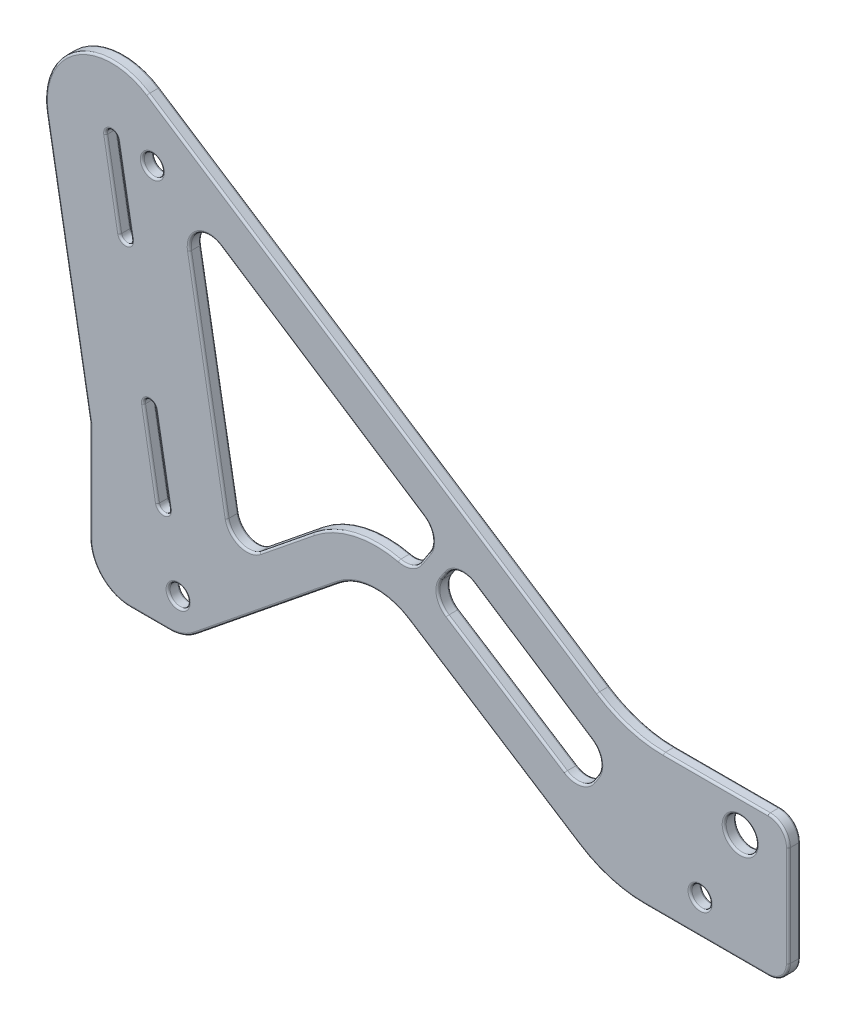
from build123d import *

# Parameters (mm, degrees)
SKETCH1_R           = 2.5
SKETCH1_R_2         = 4
BOSS_EXTRUDE1_DEPTH = 3
FILLET1_R           = 5
CUT_EXTRUDE1_DEPTH  = 10
CUT_EXTRUDE2_DEPTH  = 10
FILLET3_R           = 30
FILLET4_R           = 10
FILLET5_R           = 0.5
SKETCH4_R           = 2.5
CUT_EXTRUDE3_DEPTH  = 10
FILLET6_R           = 0.5


with BuildPart() as part:
    # Sketch1 → Boss-Extrude1 (new body)
    # profile 1 of 3: a face of its own
    with BuildSketch(Plane.XY):
        with BuildLine():
            Line((0, 21.354191767), (0, 35))
            Line((0, 35), (-36.042003765, 35))
            Line((-36.042003765, 35), (-47.769437248, 35))
            Line((-47.769437248, 35), (-136.490921808, 35))
            Line((-136.490921808, 35), (-148.304829515, 102))
            ThreePointArc((-148.304829515, 102), (-150.785627379, 108.227526332), (-155.539001023, 112.954246258))
            ThreePointArc((-155.539001023, 112.954246258), (-173.646878703, 112.903335129), (-180.803485365, 96.269610137))
            Line((-180.803485365, 96.269610137), (-170, 35))
            Line((-170, 35), (-170, 0))
            Line((-170, 0), (0, 0))
            Line((0, 0), (0, 21.354191767))
        make_face()
        with Locations((-148, 8.5)):
            Circle(SKETCH1_R, mode=Mode.SUBTRACT)
        with BuildLine():
            ThreePointArc((-156.60869326, 45.435682794), (-155.391953897, 47.17336669), (-153.654270001, 45.956627327))
            Line((-153.654270001, 45.956627327), (-150.181306448, 26.260472267))
            ThreePointArc((-150.181306448, 26.260472267), (-151.398045811, 24.52278837), (-153.135729707, 25.739527733))
            Line((-153.135729707, 25.739527733), (-156.60869326, 45.435682794))
        make_face(mode=Mode.SUBTRACT)
        with Locations((-18, 8.5)):
            Circle(SKETCH1_R, mode=Mode.SUBTRACT)
        with Locations((-8, 27)):
            Circle(SKETCH1_R_2, mode=Mode.SUBTRACT)
        with BuildLine():
            Line((-162.558405516, 79.178177742), (-166.031369069, 98.874332802))
            ThreePointArc((-166.031369069, 98.874332802), (-164.814629706, 100.612016698), (-163.07694581, 99.395277335))
            Line((-163.07694581, 99.395277335), (-159.603982257, 79.699122275))
            ThreePointArc((-159.603982257, 79.699122275), (-160.82072162, 77.961438379), (-162.558405516, 79.178177742))
        make_face(mode=Mode.SUBTRACT)
    # profile 2 of 3: a face of its own
    with BuildSketch(Plane.XY):
        Polygon((4, 35), (0, 35), (0, 21.354191767), (0, 0), (4, 0), align=None)
    # profile 3 of 3: a face of its own
    with BuildSketch(Plane.XY):
        with BuildLine():
            Line((-47.769437248, 35), (-36.042003765, 35))
            Line((-36.042003765, 35), (-155.539001023, 112.954246258))
            ThreePointArc((-155.539001023, 112.954246258), (-150.785627379, 108.227526332), (-148.304829515, 102))
            Line((-148.304829515, 102), (-136.490921808, 35))
            Line((-136.490921808, 35), (-47.769437248, 35))
        make_face()
    extrude(amount=BOSS_EXTRUDE1_DEPTH)

    # Fillet1
    fillet1_edges = [part.edges().sort_by_distance(p)[0] for p in [
        (4, 0, 1.5),
        (4, 35, 1.5),
    ]]
    fillet(fillet1_edges, radius=FILLET1_R)

    # Sketch2 → Cut-Extrude1 (cut)
    with BuildSketch(Plane.XY):
        with BuildLine():
            Line((-40.706296183, 0), (-90.637522318, 32.020210753))
            ThreePointArc((-90.637522318, 32.020210753), (-99.553025445, 34.371188642), (-108.159390419, 31.063050953))
            Line((-108.159390419, 31.063050953), (-146.621862967, 0))
            Line((-146.621862967, 0), (-40.706296183, 0))
        make_face()
    extrude(amount=CUT_EXTRUDE1_DEPTH, mode=Mode.SUBTRACT)

    # Sketch3 → Cut-Extrude2 (cut)
    with BuildSketch(Plane(origin=(0, 0, 0), x_dir=(-1, 0, 0), z_dir=(0, 0, -1))):
        with BuildLine():
            Line((74.317260508, 48.029284178), (45.003294349, 28.906225112))
            ThreePointArc((45.003294349, 28.906225112), (42.842281502, 25.747952734), (43.547450479, 21.98665008))
            Line((43.547450479, 21.98665008), (44.647445431, 20.30045465))
            ThreePointArc((44.647445431, 20.30045465), (47.786637301, 18.143495128), (51.534262951, 18.823423031))
            Line((51.534262951, 18.823423031), (80.997440189, 37.717754648))
            ThreePointArc((80.997440189, 37.717754648), (83.187157223, 40.878134265), (82.486041572, 44.658517428))
            Line((82.486041572, 44.658517428), (81.23683554, 46.573440307))
            ThreePointArc((81.23683554, 46.573440307), (78.078563162, 48.734453155), (74.317260508, 48.029284178))
        make_face()
        with BuildLine():
            Line((145.165714603, 84.19719467), (135.807385698, 31.12347409))
            ThreePointArc((135.807385698, 31.12347409), (132.637447646, 27.309500685), (127.741832302, 28.101871046))
            Line((127.741832302, 28.101871046), (114.442419683, 38.842738818))
            ThreePointArc((114.442419683, 38.842738818), (104.289156832, 43.768704017), (93.004113234, 43.72783024))
            ThreePointArc((93.004113234, 43.72783024), (89.999922251, 43.952745528), (87.670257125, 45.862826876))
            Line((87.670257125, 45.862826876), (85.424544992, 49.305305888))
            ThreePointArc((85.424544992, 49.305305888), (84.719376015, 53.066608542), (86.880388862, 56.22488092))
            Line((86.880388862, 56.22488092), (137.509810257, 89.253145009))
            ThreePointArc((137.509810257, 89.253145009), (142.997045918, 89.237717395), (145.165714603, 84.19719467))
        make_face()
    extrude(amount=-CUT_EXTRUDE2_DEPTH, mode=Mode.SUBTRACT)

    # Fillet3
    fillet3_edges = [part.edges().sort_by_distance(p)[0] for p in [
        (-40.706296183, 0, 1.5),
        (-36.042003765, 35, 1.5),
    ]]
    fillet(fillet3_edges, radius=FILLET3_R)

    # Fillet4
    fillet4_edges = [part.edges().sort_by_distance(p)[0] for p in [
        (-146.621862967, 0, 1.5),
        (-170, 0, 1.5),
    ]]
    fillet(fillet4_edges, radius=FILLET4_R)

    # Fillet5
    fillet5_edges = [part.edges().sort_by_distance(p)[0] for p in [
        (-126.016024201, 16.641681544, 0),
        (-146.823786785, 0.571403109, 0),
        (-99.553025445, 34.371188642, 0),
        (-155.077843623, 0, 0),
        (-69.372765546, 18.383413779, 0),
        (-167.071067812, 2.928932188, 0),
        (-40.351325286, 1.211100266, 0),
        (-170, 22.5, 0),
        (-16.45668018, 0, 0),
        (-175.401742682, 65.634805068, 0),
        (2.535533906, 1.464466094, 0),
        (-173.646878703, 112.903335129, 0),
        (4, 17.5, 0),
        (-99.526012112, 76.413994775, 0),
        (2.535533906, 33.535533906, 0),
        (-35.672043127, 36.244237958, 0),
        (-14.060914857, 35, 0),
        (-150.5, 8.5, 0),
        (-155.391953897, 47.17336669, 0),
        (-154.872211484, 35.587605264, 0),
        (-151.917788225, 36.108549797, 0),
        (-151.398045811, 24.52278837, 0),
        (-20.5, 8.5, 0),
        (-12, 27, 0),
        (-78.078563162, 48.734453155, 0),
        (-81.861438556, 45.615978867, 0),
        (-83.187157223, 40.878134265, 0),
        (-66.26585157, 28.27058884, 0),
        (-47.786637301, 18.143495128, 0),
        (-44.097447955, 21.143552365, 0),
        (-42.842281502, 25.747952734, 0),
        (-59.660277429, 38.467754645, 0),
        (-140.486550151, 57.66033438, 0),
        (-132.637447646, 27.309500685, 0),
        (-121.092125992, 33.472304932, 0),
        (-104.289156832, 43.768704017, 0),
        (-89.999922251, 43.952745528, 0),
        (-86.547401058, 47.584066382, 0),
        (-84.719376015, 53.066608542, 0),
        (-112.19509956, 72.739012965, 0),
        (-142.997045918, 89.237717395, 0),
        (-164.294887293, 89.026255272, 0),
        (-160.82072162, 77.961438379, 0),
        (-164.814629706, 100.612016698, 0),
        (-161.340464034, 89.547199805, 0),
        (-126.016024201, 16.641681544, 3),
        (-146.823786785, 0.571403109, 3),
        (-99.553025445, 34.371188642, 3),
        (-155.077843623, 0, 3),
        (-69.372765546, 18.383413779, 3),
        (-167.071067812, 2.928932188, 3),
        (-40.351325286, 1.211100266, 3),
        (-170, 22.5, 3),
        (-16.45668018, 0, 3),
        (-175.401742682, 65.634805068, 3),
        (2.535533906, 1.464466094, 3),
        (-173.646878703, 112.903335129, 3),
        (4, 17.5, 3),
        (-99.526012112, 76.413994775, 3),
        (2.535533906, 33.535533906, 3),
        (-35.672043127, 36.244237958, 3),
        (-14.060914857, 35, 3),
        (-150.5, 8.5, 3),
        (-155.391953897, 47.17336669, 3),
        (-154.872211484, 35.587605264, 3),
        (-151.917788225, 36.108549797, 3),
        (-151.398045811, 24.52278837, 3),
        (-20.5, 8.5, 3),
        (-12, 27, 3),
        (-78.078563162, 48.734453155, 3),
        (-81.861438556, 45.615978867, 3),
        (-83.187157223, 40.878134265, 3),
        (-66.26585157, 28.27058884, 3),
        (-47.786637301, 18.143495128, 3),
        (-44.097447955, 21.143552365, 3),
        (-42.842281502, 25.747952734, 3),
        (-59.660277429, 38.467754645, 3),
        (-140.486550151, 57.66033438, 3),
        (-132.637447646, 27.309500685, 3),
        (-121.092125992, 33.472304932, 3),
        (-104.289156832, 43.768704017, 3),
        (-89.999922251, 43.952745528, 3),
        (-86.547401058, 47.584066382, 3),
        (-84.719376015, 53.066608542, 3),
        (-112.19509956, 72.739012965, 3),
        (-142.997045918, 89.237717395, 3),
        (-164.294887293, 89.026255272, 3),
        (-160.82072162, 77.961438379, 3),
        (-164.814629706, 100.612016698, 3),
        (-161.340464034, 89.547199805, 3),
    ]]
    fillet(fillet5_edges, radius=FILLET5_R)

    # Sketch4 → Cut-Extrude3 (cut)
    with BuildSketch(Plane(origin=(0, 0, 0), x_dir=(-1, 0, 0), z_dir=(0, 0, -1))):
        with Locations(Location((154.418812483, 98.109824652, 0), (0, 0, 180))):
            Circle(SKETCH4_R)
    extrude(amount=-CUT_EXTRUDE3_DEPTH, mode=Mode.SUBTRACT)

    # Fillet6
    fillet6_edges = [part.edges().sort_by_distance(p)[0] for p in [
        (-156.918812483, 98.109824652, 0),
        (-156.918812483, 98.109824652, 3),
    ]]
    fillet(fillet6_edges, radius=FILLET6_R)


solid = part.part
